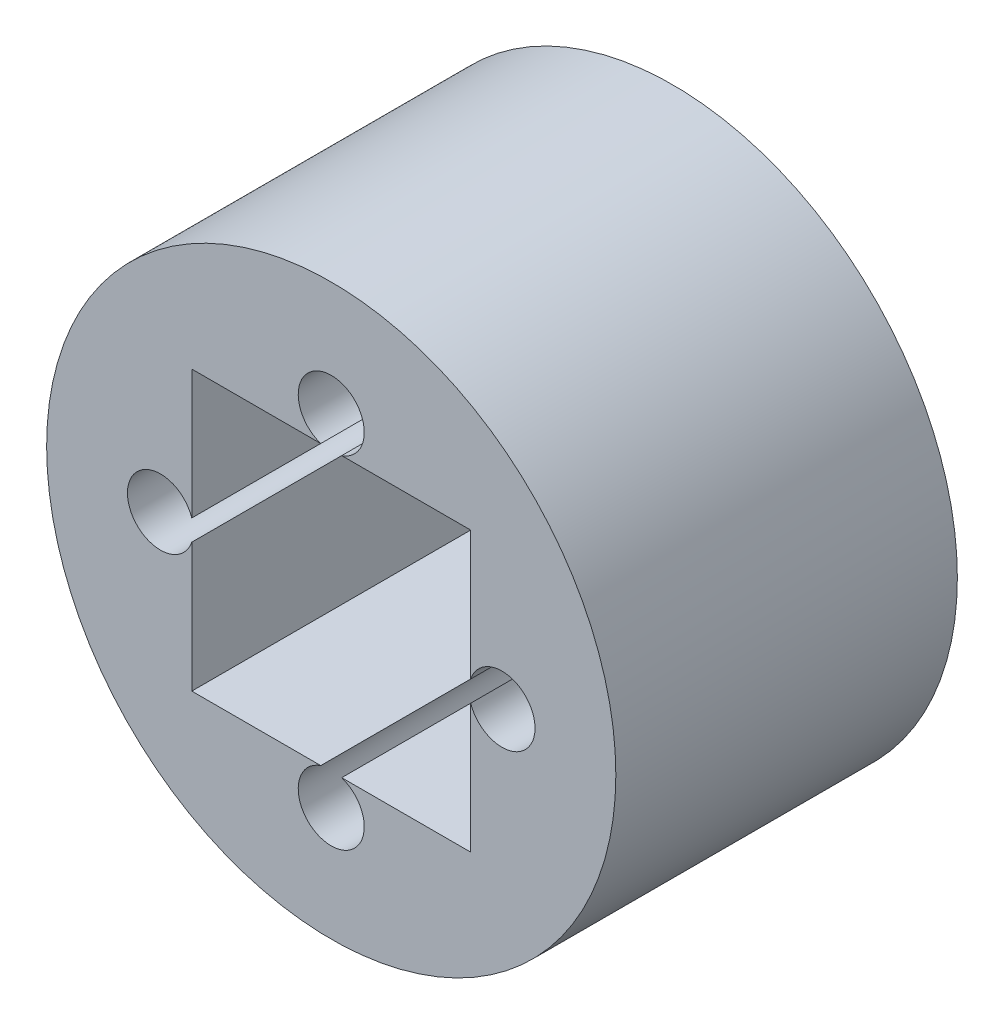
from build123d import *

# Parameters (mm, degrees)
SKETCH1_R           = 12.5
BOSS_EXTRUDE1_DEPTH = 7.5
CUT_EXTRUDE1_REACH  = 25.184
SKETCH8_W           = 12.25
SKETCH8_H           = 12.25
CUT_EXTRUDE4_REACH  = 25.184
SKETCH11_R          = 1.45


with BuildPart() as part:
    # Sketch1 → Boss-Extrude1 (new, symmetric)
    with BuildSketch(Plane.XY):
        Circle(SKETCH1_R)
    extrude(amount=BOSS_EXTRUDE1_DEPTH, both=True)

    # Sketch8 → Cut-Extrude1 (cut, up to next)
    with BuildSketch(Plane.XY.offset(7.5), mode=Mode.PRIVATE) as cut_extrude1_sk1:
        Rectangle(SKETCH8_W, SKETCH8_H)
    cut_extrude1_tool1 = extrude(cut_extrude1_sk1.sketch, amount=-CUT_EXTRUDE1_REACH, mode=Mode.PRIVATE) & part.part
    add(cut_extrude1_tool1.solids().sort_by_distance((0, 0, 7.5))[0], mode=Mode.SUBTRACT)

    # Sketch11 → Cut-Extrude4 (cut, up to next)
    with BuildSketch(Plane.XY.offset(7.5), mode=Mode.PRIVATE) as cut_extrude4_sk1:
        with Locations((7.5, 0)):
            Circle(SKETCH11_R)
    cut_extrude4_tool1 = extrude(cut_extrude4_sk1.sketch, amount=-CUT_EXTRUDE4_REACH, mode=Mode.PRIVATE) & part.part
    # Sketch11 → Cut-Extrude4 (cut, up to next)
    with BuildSketch(Plane.XY.offset(7.5), mode=Mode.PRIVATE) as cut_extrude4_sk2:
        with Locations((0, -7.5)):
            Circle(SKETCH11_R)
    cut_extrude4_tool2 = extrude(cut_extrude4_sk2.sketch, amount=-CUT_EXTRUDE4_REACH, mode=Mode.PRIVATE) & part.part
    # Sketch11 → Cut-Extrude4 (cut, up to next)
    with BuildSketch(Plane.XY.offset(7.5), mode=Mode.PRIVATE) as cut_extrude4_sk3:
        with Locations((-7.5, 0)):
            Circle(SKETCH11_R)
    cut_extrude4_tool3 = extrude(cut_extrude4_sk3.sketch, amount=-CUT_EXTRUDE4_REACH, mode=Mode.PRIVATE) & part.part
    # Sketch11 → Cut-Extrude4 (cut, up to next)
    with BuildSketch(Plane.XY.offset(7.5), mode=Mode.PRIVATE) as cut_extrude4_sk4:
        with Locations((0, 7.5)):
            Circle(SKETCH11_R)
    cut_extrude4_tool4 = extrude(cut_extrude4_sk4.sketch, amount=-CUT_EXTRUDE4_REACH, mode=Mode.PRIVATE) & part.part
    add(cut_extrude4_tool1.solids().sort_by_distance((7.5, 0, 7.5))[0], mode=Mode.SUBTRACT)
    add(cut_extrude4_tool2.solids().sort_by_distance((0, -7.5, 7.5))[0], mode=Mode.SUBTRACT)
    add(cut_extrude4_tool3.solids().sort_by_distance((-7.5, 0, 7.5))[0], mode=Mode.SUBTRACT)
    add(cut_extrude4_tool4.solids().sort_by_distance((0, 7.5, 7.5))[0], mode=Mode.SUBTRACT)


solid = part.part
